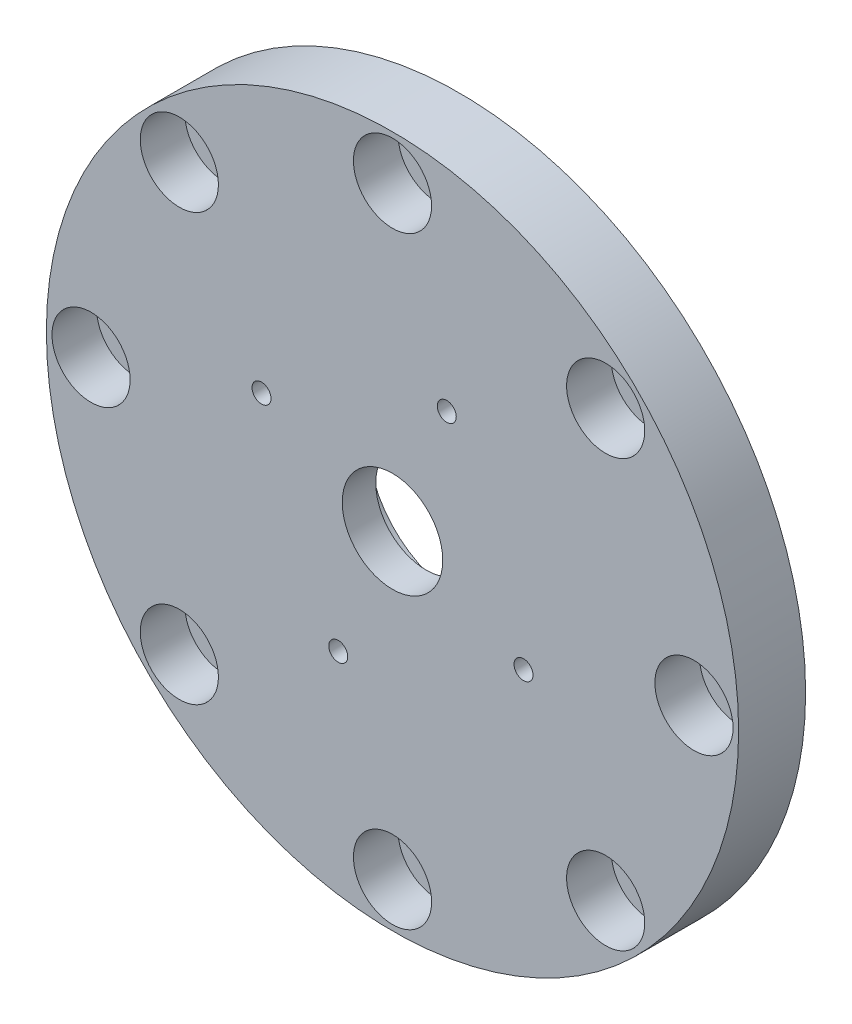
from build123d import *

# Parameters (mm, degrees)
SKETCH1_R           = 31
SKETCH1_R_2         = 4.5
SKETCH1_R_3         = 0.85
SKETCH1_R_4         = 1.55
BOSS_EXTRUDE2_DEPTH = 6
SKETCH5_R           = 8.2
CUT_EXTRUDE3_DEPTH  = 3
SKETCH6_R           = 3.5
CUT_EXTRUDE4_DEPTH  = 4
SKETCH7_R           = 2.2
CUT_EXTRUDE5_DEPTH  = 2


with BuildPart() as part:
    # Sketch1 → Boss-Extrude2 (new body)
    with BuildSketch(Plane.XY):
        Circle(SKETCH1_R)
        Circle(SKETCH1_R_2, mode=Mode.SUBTRACT)
        with Locations((4.860079591, 11.733270063)):
            Circle(SKETCH1_R_3, mode=Mode.SUBTRACT)
        with Locations((11.733270063, -4.860079591)):
            Circle(SKETCH1_R_3, mode=Mode.SUBTRACT)
        with Locations((-4.860079591, -11.733270063)):
            Circle(SKETCH1_R_3, mode=Mode.SUBTRACT)
        with Locations((-11.733270063, 4.860079591)):
            Circle(SKETCH1_R_3, mode=Mode.SUBTRACT)
        with Locations((-27, 0)):
            Circle(SKETCH1_R_4, mode=Mode.SUBTRACT)
        with Locations((-19.091883092, 19.091883092)):
            Circle(SKETCH1_R_4, mode=Mode.SUBTRACT)
        with Locations((0, 27)):
            Circle(SKETCH1_R_4, mode=Mode.SUBTRACT)
        with Locations((19.091883092, 19.091883092)):
            Circle(SKETCH1_R_4, mode=Mode.SUBTRACT)
        with Locations((27, 0)):
            Circle(SKETCH1_R_4, mode=Mode.SUBTRACT)
        with Locations((19.091883092, -19.091883092)):
            Circle(SKETCH1_R_4, mode=Mode.SUBTRACT)
        with Locations((0, -27)):
            Circle(SKETCH1_R_4, mode=Mode.SUBTRACT)
        with Locations((-19.091883092, -19.091883092)):
            Circle(SKETCH1_R_4, mode=Mode.SUBTRACT)
    extrude(amount=BOSS_EXTRUDE2_DEPTH)

    # Sketch5 → Cut-Extrude3 (cut)
    with BuildSketch(Plane(origin=(0, 0, 0), x_dir=(-1, 0, 0), z_dir=(0, 0, -1))):
        Circle(SKETCH5_R)
    extrude(amount=-CUT_EXTRUDE3_DEPTH, mode=Mode.SUBTRACT)

    # Sketch6 → Cut-Extrude4 (cut)
    with BuildSketch(Plane.XY.offset(6)):
        with Locations((0, 27)):
            Circle(SKETCH6_R)
        with Locations((19.091883092, 19.091883092)):
            Circle(SKETCH6_R)
        with Locations((27, 0)):
            Circle(SKETCH6_R)
        with Locations((19.091883092, -19.091883092)):
            Circle(SKETCH6_R)
        with Locations((0, -27)):
            Circle(SKETCH6_R)
        with Locations((-19.091883092, -19.091883092)):
            Circle(SKETCH6_R)
        with Locations((-27, 0)):
            Circle(SKETCH6_R)
        with Locations((-19.091883092, 19.091883092)):
            Circle(SKETCH6_R)
    extrude(amount=-CUT_EXTRUDE4_DEPTH, mode=Mode.SUBTRACT)

    # Sketch7 → Cut-Extrude5 (cut)
    with BuildSketch(Plane(origin=(0, 0, 0), x_dir=(-1, 0, 0), z_dir=(0, 0, -1))):
        with Locations((-4.860079591, 11.733270063)):
            Circle(SKETCH7_R)
        with Locations((11.733270063, 4.860079591)):
            Circle(SKETCH7_R)
        with Locations((4.860079591, -11.733270063)):
            Circle(SKETCH7_R)
        with Locations((-11.733270063, -4.860079591)):
            Circle(SKETCH7_R)
    extrude(amount=-CUT_EXTRUDE5_DEPTH, mode=Mode.SUBTRACT)


solid = part.part
